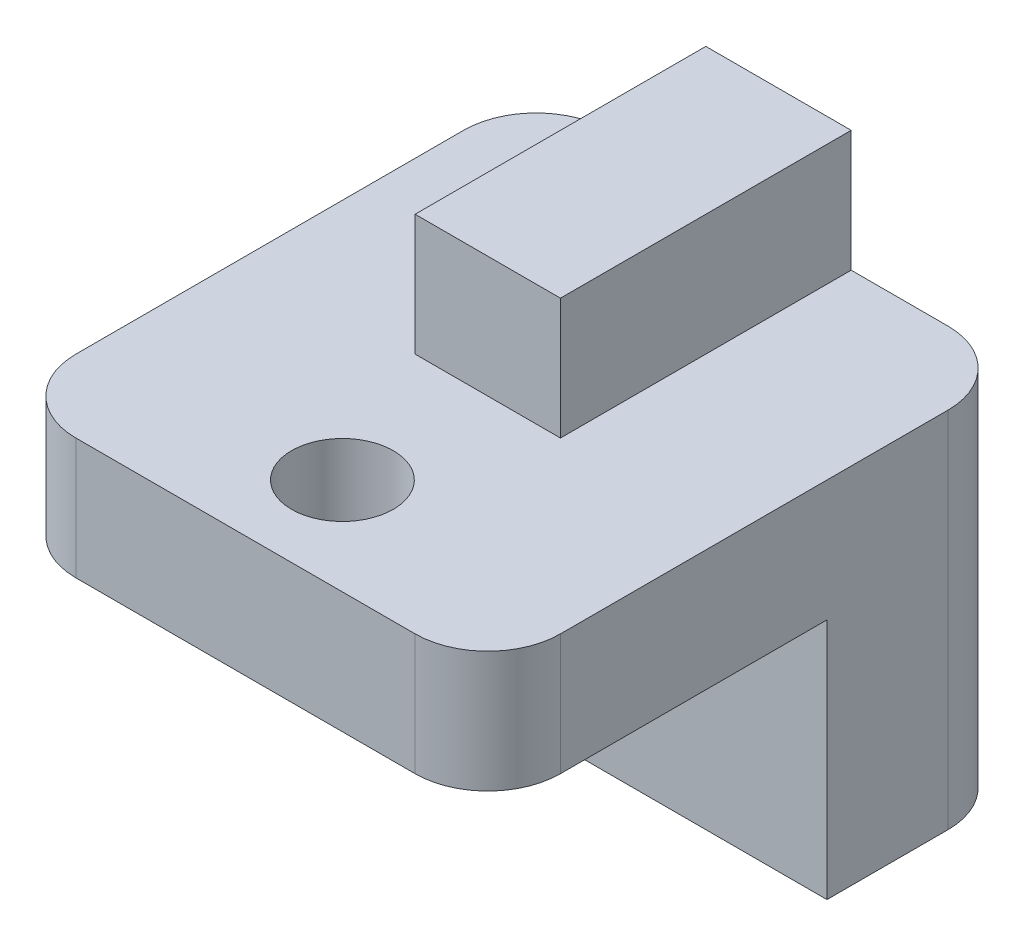
from build123d import *

# Parameters (mm, degrees)
SKETCH_1_R      = 2.1
EXTRUDE_1_DEPTH = 5
EXTRUDE_START   = 5
SKETCH_1_3_W    = 6
SKETCH_1_3_H    = 12
EXTRUDE_2_DEPTH = 5
FILLET_2_R      = 3
EXTRUDE_3_DEPTH = 10


with BuildPart() as part:
    # 草图1 → 凸台-拉伸1 (new body)
    # profile 1 of 10: a face of its own
    with BuildSketch(Plane(origin=(0, 0, 0), x_dir=(1, 0, 0), z_dir=(0, 1, 0))):
        with BuildLine():
            Line((0, 22), (0, 0))
            Line((0, 0), (20, 0))
            Line((20, 0), (20, 22))
            Line((20, 22), (13, 22))
            Line((13, 22), (13, 17.968245837))
            ThreePointArc((13, 17.968245837), (13.862372436, 17.790569415), (14.25, 17))
            ThreePointArc((14.25, 17), (13.862372436, 16.209430585), (13, 16.031754163))
            Line((13, 16.031754163), (13, 10))
            Line((13, 10), (7, 10))
            Line((7, 10), (7, 16.031754163))
            ThreePointArc((7, 16.031754163), (5.75, 17), (7, 17.968245837))
            Line((7, 17.968245837), (7, 22))
            Line((7, 22), (0, 22))
        make_face()
        with Locations(Location((10, 4, 0), (0, 0, 270))):
            Circle(SKETCH_1_R, mode=Mode.SUBTRACT)
    # profile 2 of 10: a face of its own
    with BuildSketch(Plane(origin=(0, 0, 0), x_dir=(1, 0, 0), z_dir=(0, 1, 0))):
        with BuildLine():
            Line((13, 22), (7, 22))
            Line((7, 22), (7, 17.968245837))
            ThreePointArc((7, 17.968245837), (7.540569415, 17.612372436), (7.75, 17))
            ThreePointArc((7.75, 17), (7.540569415, 16.387627564), (7, 16.031754163))
            Line((7, 16.031754163), (7, 10))
            Line((7, 10), (13, 10))
            Line((13, 10), (13, 16.031754163))
            ThreePointArc((13, 16.031754163), (12.25, 17), (13, 17.968245837))
            Line((13, 17.968245837), (13, 22))
        make_face()
    # profile 3 of 10: a face of its own
    with BuildSketch(Plane(origin=(0, 0, 0), x_dir=(1, 0, 0), z_dir=(0, 1, 0))):
        with BuildLine():
            ThreePointArc((14.25, 17), (13.862372436, 17.790569415), (13, 17.968245837))
            Line((13, 17.968245837), (13, 16.031754163))
            ThreePointArc((13, 16.031754163), (13.862372436, 16.209430585), (14.25, 17))
        make_face()
    # profile 4 of 10: a face of its own
    with BuildSketch(Plane(origin=(0, 0, 0), x_dir=(1, 0, 0), z_dir=(0, 1, 0))):
        with BuildLine():
            Line((13, 16.031754163), (13, 17.968245837))
            ThreePointArc((13, 17.968245837), (12.25, 17), (13, 16.031754163))
        make_face()
    # profile 5 of 10: a face of its own
    with BuildSketch(Plane(origin=(0, 0, 0), x_dir=(1, 0, 0), z_dir=(0, 1, 0))):
        with BuildLine():
            ThreePointArc((14.25, 17), (13.862372436, 17.790569415), (13, 17.968245837))
            Line((13, 17.968245837), (13, 16.031754163))
            ThreePointArc((13, 16.031754163), (13.862372436, 16.209430585), (14.25, 17))
        make_face()
    # profile 6 of 10: a face of its own
    with BuildSketch(Plane(origin=(0, 0, 0), x_dir=(1, 0, 0), z_dir=(0, 1, 0))):
        with BuildLine():
            Line((13, 16.031754163), (13, 17.968245837))
            ThreePointArc((13, 17.968245837), (12.25, 17), (13, 16.031754163))
        make_face()
    # profile 7 of 10: a face of its own
    with BuildSketch(Plane(origin=(0, 0, 0), x_dir=(1, 0, 0), z_dir=(0, 1, 0))):
        with BuildLine():
            ThreePointArc((7.75, 17), (7.540569415, 17.612372436), (7, 17.968245837))
            Line((7, 17.968245837), (7, 16.031754163))
            ThreePointArc((7, 16.031754163), (7.540569415, 16.387627564), (7.75, 17))
        make_face()
    # profile 8 of 10: a face of its own
    with BuildSketch(Plane(origin=(0, 0, 0), x_dir=(1, 0, 0), z_dir=(0, 1, 0))):
        with BuildLine():
            Line((7, 16.031754163), (7, 17.968245837))
            ThreePointArc((7, 17.968245837), (5.75, 17), (7, 16.031754163))
        make_face()
    # profile 9 of 10: a face of its own
    with BuildSketch(Plane(origin=(0, 0, 0), x_dir=(1, 0, 0), z_dir=(0, 1, 0))):
        with BuildLine():
            ThreePointArc((7.75, 17), (7.540569415, 17.612372436), (7, 17.968245837))
            Line((7, 17.968245837), (7, 16.031754163))
            ThreePointArc((7, 16.031754163), (7.540569415, 16.387627564), (7.75, 17))
        make_face()
    # profile 10 of 10: a face of its own
    with BuildSketch(Plane(origin=(0, 0, 0), x_dir=(1, 0, 0), z_dir=(0, 1, 0))):
        with BuildLine():
            Line((7, 16.031754163), (7, 17.968245837))
            ThreePointArc((7, 17.968245837), (5.75, 17), (7, 16.031754163))
        make_face()
    extrude(amount=EXTRUDE_1_DEPTH)

    # 草图1<3> → 凸台-拉伸2 (add)
    with BuildSketch(Plane(origin=(0, 0, 0), x_dir=(1, 0, 0), z_dir=(0, 1, 0)).offset(EXTRUDE_START)):
        with Locations((10, 16)):
            Rectangle(SKETCH_1_3_W, SKETCH_1_3_H)
    extrude(amount=EXTRUDE_2_DEPTH)

    # 圆角2
    fillet_2_edges = [part.edges().sort_by_distance(p)[0] for p in [
        (20, 2.5, 0),
        (0, 2.5, 0),
        (0, 2.5, -22),
        (20, 2.5, -22),
    ]]
    fillet(fillet_2_edges, radius=FILLET_2_R)

    # 草图2 → 凸台-拉伸3 (add)
    with BuildSketch(Plane.XZ):
        with BuildLine():
            Line((3, -22), (17, -22))
            ThreePointArc((17, -22), (19.121320344, -21.121320344), (20, -19))
            Line((20, -19), (20, -14))
            Line((20, -14), (0, -14))
            Line((0, -14), (0, -19))
            ThreePointArc((0, -19), (0.878679656, -21.121320344), (3, -22))
        make_face()
    extrude(amount=EXTRUDE_3_DEPTH)


solid = part.part
